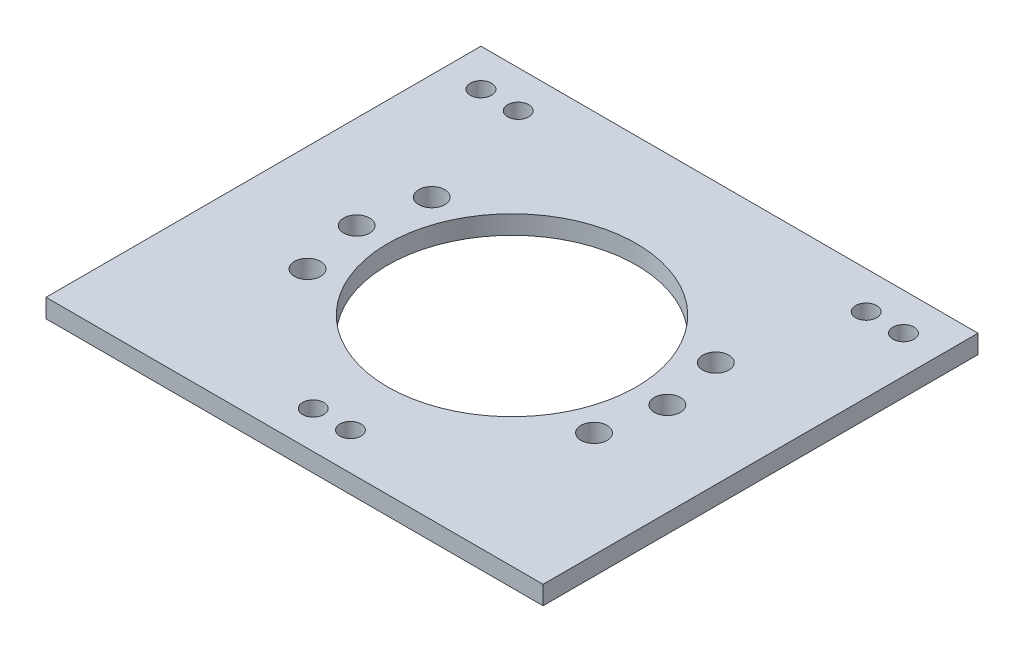
from build123d import *

# Parameters (mm, degrees)
BASE_W                        = 80
BASE_H                        = 70
BASE_PLATE_DEPTH              = 3
EXTRUDER_HOLE_CUT_REACH       = 55.235
EXTRUDER_HOLE_R               = 20
EXTRUDER_SREW_HOLES_CUT_REACH = 55.235
EXTRUDER_MOUNT_HOLES_R        = 2.1
LM8_TWO_REACH                 = 55.235
LM8UU_HOLES_R                 = 1.7
LM8_CENTER_REACH              = 55.235
LM8UU_CENTER_R                = 1.7


with BuildPart() as part:
    # Base → Base Plate (new body)
    with BuildSketch(Plane(origin=(0, 0, 0), x_dir=(1, 0, 0), z_dir=(0, 1, 0))):
        Rectangle(BASE_W, BASE_H)
    extrude(amount=BASE_PLATE_DEPTH)

    # Extruder hole → Extruder Hole Cut (cut, up to next)
    with BuildSketch(Plane(origin=(0, 3, 0), x_dir=(1, 0, 0), z_dir=(0, 1, 0)), mode=Mode.PRIVATE) as extruder_hole_cut_sk1:
        with Locations(Location((0, 0, 0), (0, 0, 270))):
            Circle(EXTRUDER_HOLE_R)
    extruder_hole_cut_tool1 = extrude(extruder_hole_cut_sk1.sketch, amount=-EXTRUDER_HOLE_CUT_REACH, mode=Mode.PRIVATE) & part.part
    add(extruder_hole_cut_tool1.solids().sort_by_distance((0, 3, 0))[0], mode=Mode.SUBTRACT)

    # Extruder Mount Holes → Extruder Srew Holes Cut (cut, up to next)
    with BuildSketch(Plane(origin=(0, 3, 0), x_dir=(1, 0, 0), z_dir=(0, 1, 0)), mode=Mode.PRIVATE) as extruder_srew_holes_cut_sk1:
        with Locations(Location((-25, 0, 0), (0, 0, 270))):
            Circle(EXTRUDER_MOUNT_HOLES_R)
    extruder_srew_holes_cut_tool1 = extrude(extruder_srew_holes_cut_sk1.sketch, amount=-EXTRUDER_SREW_HOLES_CUT_REACH, mode=Mode.PRIVATE) & part.part
    # Extruder Mount Holes → Extruder Srew Holes Cut (cut, up to next)
    with BuildSketch(Plane(origin=(0, 3, 0), x_dir=(1, 0, 0), z_dir=(0, 1, 0)), mode=Mode.PRIVATE) as extruder_srew_holes_cut_sk2:
        with Locations(Location((-22.912878475, 10, 0), (0, 0, 270))):
            Circle(EXTRUDER_MOUNT_HOLES_R)
    extruder_srew_holes_cut_tool2 = extrude(extruder_srew_holes_cut_sk2.sketch, amount=-EXTRUDER_SREW_HOLES_CUT_REACH, mode=Mode.PRIVATE) & part.part
    # Extruder Mount Holes → Extruder Srew Holes Cut (cut, up to next)
    with BuildSketch(Plane(origin=(0, 3, 0), x_dir=(1, 0, 0), z_dir=(0, 1, 0)), mode=Mode.PRIVATE) as extruder_srew_holes_cut_sk3:
        with Locations(Location((-22.912878475, -10, 0), (0, 0, 270))):
            Circle(EXTRUDER_MOUNT_HOLES_R)
    extruder_srew_holes_cut_tool3 = extrude(extruder_srew_holes_cut_sk3.sketch, amount=-EXTRUDER_SREW_HOLES_CUT_REACH, mode=Mode.PRIVATE) & part.part
    # Extruder Mount Holes → Extruder Srew Holes Cut (cut, up to next)
    with BuildSketch(Plane(origin=(0, 3, 0), x_dir=(1, 0, 0), z_dir=(0, 1, 0)), mode=Mode.PRIVATE) as extruder_srew_holes_cut_sk4:
        with Locations(Location((25, 0, 0), (0, 0, 270))):
            Circle(EXTRUDER_MOUNT_HOLES_R)
    extruder_srew_holes_cut_tool4 = extrude(extruder_srew_holes_cut_sk4.sketch, amount=-EXTRUDER_SREW_HOLES_CUT_REACH, mode=Mode.PRIVATE) & part.part
    # Extruder Mount Holes → Extruder Srew Holes Cut (cut, up to next)
    with BuildSketch(Plane(origin=(0, 3, 0), x_dir=(1, 0, 0), z_dir=(0, 1, 0)), mode=Mode.PRIVATE) as extruder_srew_holes_cut_sk5:
        with Locations(Location((23, 9.797958971, 0), (0, 0, 270))):
            Circle(EXTRUDER_MOUNT_HOLES_R)
    extruder_srew_holes_cut_tool5 = extrude(extruder_srew_holes_cut_sk5.sketch, amount=-EXTRUDER_SREW_HOLES_CUT_REACH, mode=Mode.PRIVATE) & part.part
    # Extruder Mount Holes → Extruder Srew Holes Cut (cut, up to next)
    with BuildSketch(Plane(origin=(0, 3, 0), x_dir=(1, 0, 0), z_dir=(0, 1, 0)), mode=Mode.PRIVATE) as extruder_srew_holes_cut_sk6:
        with Locations(Location((23, -9.797958971, 0), (0, 0, 270))):
            Circle(EXTRUDER_MOUNT_HOLES_R)
    extruder_srew_holes_cut_tool6 = extrude(extruder_srew_holes_cut_sk6.sketch, amount=-EXTRUDER_SREW_HOLES_CUT_REACH, mode=Mode.PRIVATE) & part.part
    add(extruder_srew_holes_cut_tool1.solids().sort_by_distance((-25, 3, 0))[0], mode=Mode.SUBTRACT)
    add(extruder_srew_holes_cut_tool2.solids().sort_by_distance((-22.912878, 3, -10))[0], mode=Mode.SUBTRACT)
    add(extruder_srew_holes_cut_tool3.solids().sort_by_distance((-22.912878, 3, 10))[0], mode=Mode.SUBTRACT)
    add(extruder_srew_holes_cut_tool4.solids().sort_by_distance((25, 3, 0))[0], mode=Mode.SUBTRACT)
    add(extruder_srew_holes_cut_tool5.solids().sort_by_distance((23, 3, -9.797959))[0], mode=Mode.SUBTRACT)
    add(extruder_srew_holes_cut_tool6.solids().sort_by_distance((23, 3, 9.797959))[0], mode=Mode.SUBTRACT)

    # LM8uu Holes → LM8 Two (cut, up to next)
    with BuildSketch(Plane(origin=(0, 3, 0), x_dir=(1, 0, 0), z_dir=(0, 1, 0)), mode=Mode.PRIVATE) as lm8_two_sk1:
        with Locations(Location((-34, 29, 0), (0, 0, 270))):
            Circle(LM8UU_HOLES_R)
    lm8_two_tool1 = extrude(lm8_two_sk1.sketch, amount=-LM8_TWO_REACH, mode=Mode.PRIVATE) & part.part
    # LM8uu Holes → LM8 Two (cut, up to next)
    with BuildSketch(Plane(origin=(0, 3, 0), x_dir=(1, 0, 0), z_dir=(0, 1, 0)), mode=Mode.PRIVATE) as lm8_two_sk2:
        with Locations(Location((-28, 29, 0), (0, 0, 270))):
            Circle(LM8UU_HOLES_R)
    lm8_two_tool2 = extrude(lm8_two_sk2.sketch, amount=-LM8_TWO_REACH, mode=Mode.PRIVATE) & part.part
    # LM8uu Holes → LM8 Two (cut, up to next)
    with BuildSketch(Plane(origin=(0, 3, 0), x_dir=(1, 0, 0), z_dir=(0, 1, 0)), mode=Mode.PRIVATE) as lm8_two_sk3:
        with Locations(Location((28, 29, 0), (0, 0, 270))):
            Circle(LM8UU_HOLES_R)
    lm8_two_tool3 = extrude(lm8_two_sk3.sketch, amount=-LM8_TWO_REACH, mode=Mode.PRIVATE) & part.part
    # LM8uu Holes → LM8 Two (cut, up to next)
    with BuildSketch(Plane(origin=(0, 3, 0), x_dir=(1, 0, 0), z_dir=(0, 1, 0)), mode=Mode.PRIVATE) as lm8_two_sk4:
        with Locations(Location((34, 29, 0), (0, 0, 270))):
            Circle(LM8UU_HOLES_R)
    lm8_two_tool4 = extrude(lm8_two_sk4.sketch, amount=-LM8_TWO_REACH, mode=Mode.PRIVATE) & part.part
    add(lm8_two_tool1.solids().sort_by_distance((-34, 3, -29))[0], mode=Mode.SUBTRACT)
    add(lm8_two_tool2.solids().sort_by_distance((-28, 3, -29))[0], mode=Mode.SUBTRACT)
    add(lm8_two_tool3.solids().sort_by_distance((28, 3, -29))[0], mode=Mode.SUBTRACT)
    add(lm8_two_tool4.solids().sort_by_distance((34, 3, -29))[0], mode=Mode.SUBTRACT)

    # LM8uu Center → LM8 Center (cut, up to next)
    with BuildSketch(Plane(origin=(0, 3, 0), x_dir=(1, 0, 0), z_dir=(0, 1, 0)), mode=Mode.PRIVATE) as lm8_center_sk1:
        with Locations(Location((-3, -29, 0), (0, 0, 270))):
            Circle(LM8UU_CENTER_R)
    lm8_center_tool1 = extrude(lm8_center_sk1.sketch, amount=-LM8_CENTER_REACH, mode=Mode.PRIVATE) & part.part
    # LM8uu Center → LM8 Center (cut, up to next)
    with BuildSketch(Plane(origin=(0, 3, 0), x_dir=(1, 0, 0), z_dir=(0, 1, 0)), mode=Mode.PRIVATE) as lm8_center_sk2:
        with Locations(Location((3, -29, 0), (0, 0, 270))):
            Circle(LM8UU_CENTER_R)
    lm8_center_tool2 = extrude(lm8_center_sk2.sketch, amount=-LM8_CENTER_REACH, mode=Mode.PRIVATE) & part.part
    add(lm8_center_tool1.solids().sort_by_distance((-3, 3, 29))[0], mode=Mode.SUBTRACT)
    add(lm8_center_tool2.solids().sort_by_distance((3, 3, 29))[0], mode=Mode.SUBTRACT)


solid = part.part
